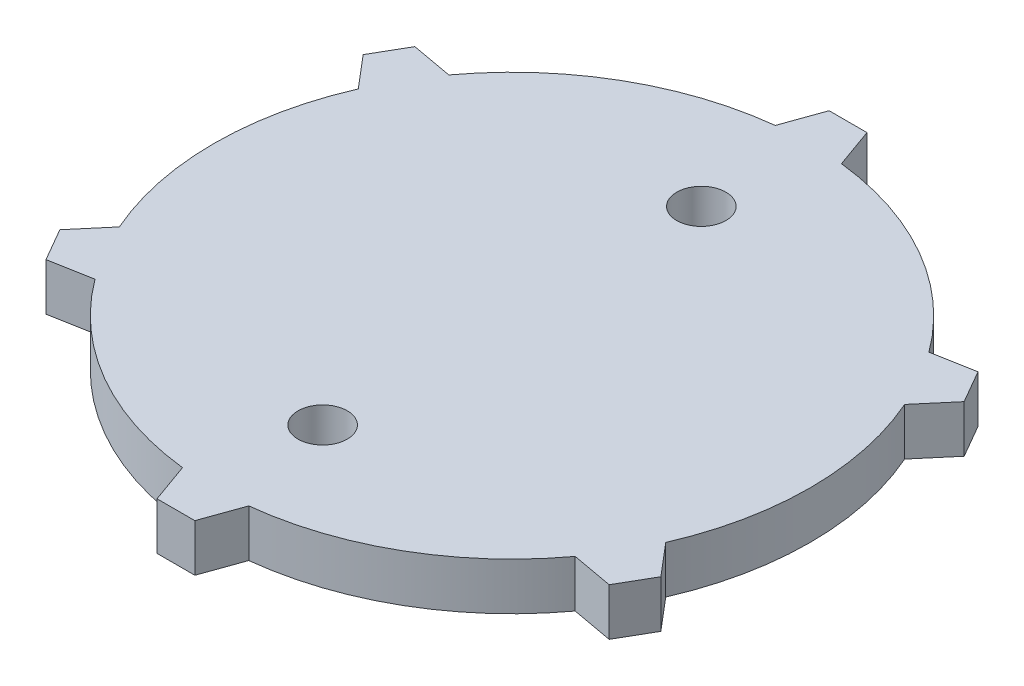
from build123d import *

# Parameters (mm, degrees)
BOSS_EXTRUDE1_DEPTH = 5
SKETCH2_R           = 2.6
CUT_EXTRUDE1_DEPTH  = 5


with BuildPart() as part:
    # Sketch1 → Boss-Extrude1 (new body)
    with BuildSketch(Plane(origin=(0, 0, 0), x_dir=(1, 0, 0), z_dir=(0, 1, 0))):
        with BuildLine():
            Line((2, 35.5), (-2, 35.5))
            Line((-2, 35.5), (-3.5, 31.304951685))
            ThreePointArc((-3.5, 31.304951685), (-15.75, 27.279800219), (-25.360883423, 18.683564756))
            Line((-25.360883423, 18.683564756), (-29.743901834, 19.482050808))
            Line((-29.743901834, 19.482050808), (-31.743901834, 16.017949192))
            Line((-31.743901834, 16.017949192), (-28.860883423, 12.621386929))
            ThreePointArc((-28.860883423, 12.621386929), (-31.5, 0), (-28.860883423, -12.621386929))
            Line((-28.860883423, -12.621386929), (-31.743901834, -16.017949192))
            Line((-31.743901834, -16.017949192), (-29.743901834, -19.482050808))
            Line((-29.743901834, -19.482050808), (-25.360883423, -18.683564756))
            ThreePointArc((-25.360883423, -18.683564756), (-15.75, -27.279800219), (-3.5, -31.304951685))
            Line((-3.5, -31.304951685), (-2, -35.5))
            Line((-2, -35.5), (2, -35.5))
            Line((2, -35.5), (3.5, -31.304951685))
            ThreePointArc((3.5, -31.304951685), (15.75, -27.279800219), (25.360883423, -18.683564756))
            Line((25.360883423, -18.683564756), (29.743901834, -19.482050808))
            Line((29.743901834, -19.482050808), (31.743901834, -16.017949192))
            Line((31.743901834, -16.017949192), (28.860883423, -12.621386929))
            ThreePointArc((28.860883423, -12.621386929), (31.5, 0), (28.860883423, 12.621386929))
            Line((28.860883423, 12.621386929), (31.743901834, 16.017949192))
            Line((31.743901834, 16.017949192), (29.743901834, 19.482050808))
            Line((29.743901834, 19.482050808), (25.360883423, 18.683564756))
            ThreePointArc((25.360883423, 18.683564756), (15.75, 27.279800219), (3.5, 31.304951685))
            Line((3.5, 31.304951685), (2, 35.5))
        make_face()
    extrude(amount=BOSS_EXTRUDE1_DEPTH)

    # Sketch2 → Cut-Extrude1 (cut)
    with BuildSketch(Plane(origin=(0, 5, 0), x_dir=(1, 0, 0), z_dir=(0, 1, 0))):
        with Locations(Location((0, 20, 0), (0, 0, 270))):
            Circle(SKETCH2_R)
        with Locations(Location((0, -20, 0), (0, 0, 90))):
            Circle(SKETCH2_R)
    extrude(amount=-CUT_EXTRUDE1_DEPTH, mode=Mode.SUBTRACT)


solid = part.part
